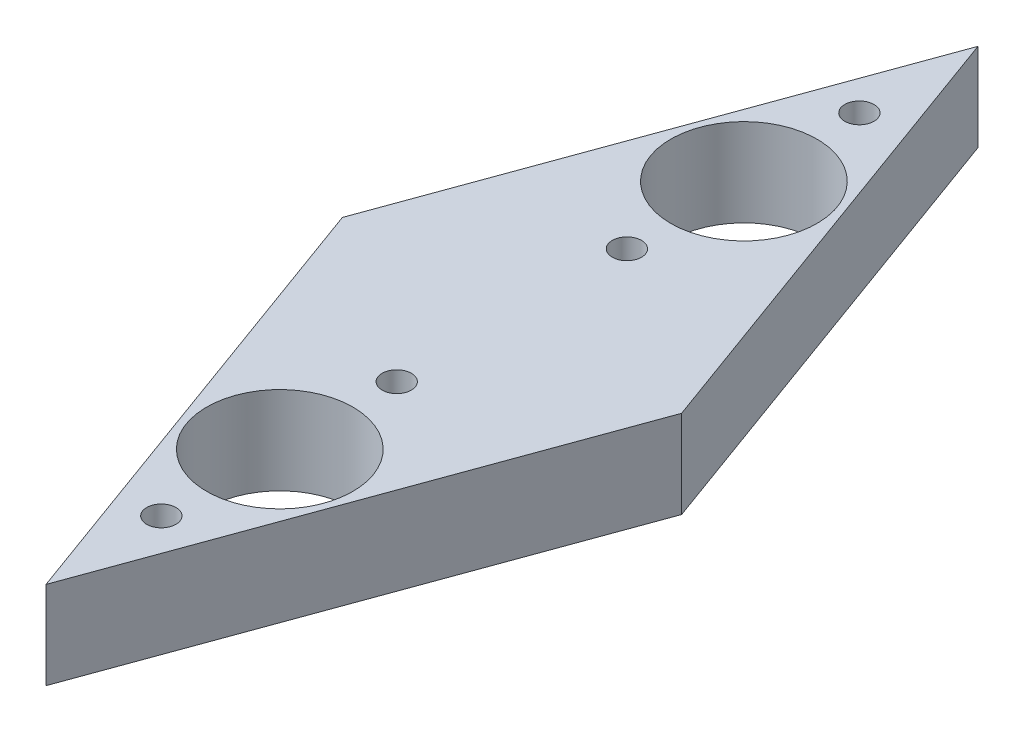
from build123d import *

# Parameters (mm, degrees)
BOSS_EXTRUDE1_DEPTH = 15
SKETCH3_R           = 2.5
SKETCH3_R_2         = 12.5
CUT_EXTRUDE1_DEPTH  = 100.686506887


with BuildPart() as part:
    # Sketch1 → Boss-Extrude1 (new body)
    with BuildSketch(Plane(origin=(0, 0, 0), x_dir=(1, 0, 0), z_dir=(0, 1, 0))):
        Polygon((0, 0), (29, 79.676845164), (58, 0), align=None)
        Polygon((0, 0), (58, 0), (29, -79.676845164), align=None)
    extrude(amount=BOSS_EXTRUDE1_DEPTH)

    # Sketch3 → Cut-Extrude1 (cut, through all)
    with BuildSketch(Plane.XZ):
        with Locations(Location((28.720595315, 59.676845164, 0), (0, 0, 270))):
            Circle(SKETCH3_R)
        with Locations(Location((28.971190629, 39.676845164, 0), (0, 0, 270))):
            Circle(SKETCH3_R_2)
        with Locations(Location((28.971190629, 19.676845164, 0), (0, 0, 270))):
            Circle(SKETCH3_R)
        with Locations(Location((28.720595315, -59.676845164, 0), (0, 0, 90))):
            Circle(SKETCH3_R)
        with Locations(Location((28.971190629, -19.676845164, 0), (0, 0, 90))):
            Circle(SKETCH3_R)
        with Locations(Location((28.971190629, -39.676845164, 0), (0, 0, 90))):
            Circle(SKETCH3_R_2)
    extrude(amount=-CUT_EXTRUDE1_DEPTH, mode=Mode.SUBTRACT)


solid = part.part
